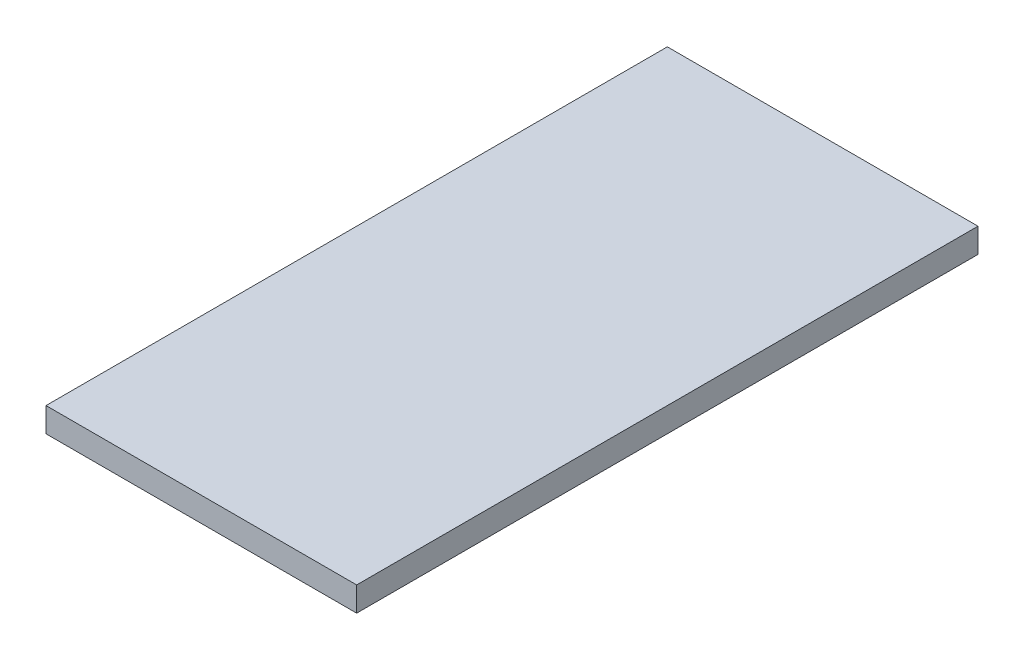
from build123d import *

# Parameters (mm, degrees)
SKETCH1_W           = 25.4
SKETCH1_H           = 50.8
BOSS_EXTRUDE1_DEPTH = 2


with BuildPart() as part:
    # Sketch1 → Boss-Extrude1 (new body)
    with BuildSketch(Plane(origin=(0, 0, 0), x_dir=(1, 0, 0), z_dir=(0, 1, 0))):
        with Locations((12.7, 25.4)):
            Rectangle(SKETCH1_W, SKETCH1_H)
    extrude(amount=BOSS_EXTRUDE1_DEPTH)


solid = part.part
